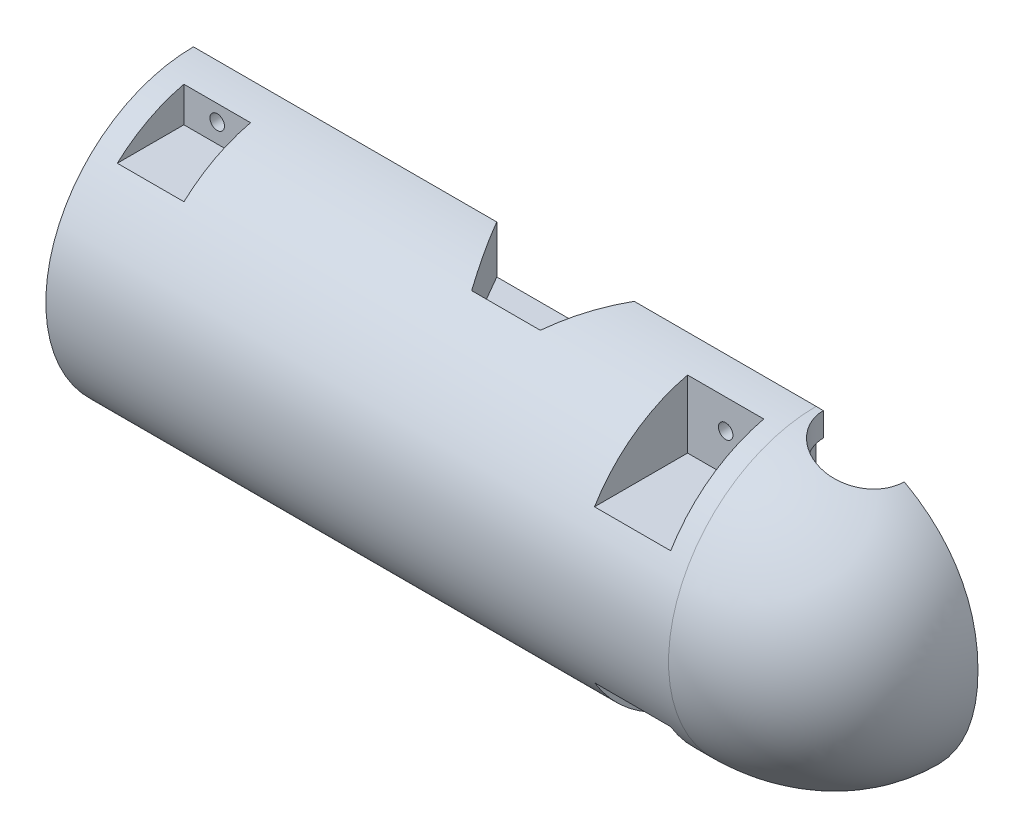
from build123d import *

# Parameters (mm, degrees)
REVOLVE1_ANGLE          = 180
CUT_EXTRUDE1_REACH      = 114.566
CUT_EXTRUDE1_END_RADIUS = 31
SKETCH2_W               = 14
SKETCH2_H               = 8.185848791
SKETCH2_W_2             = 16
SKETCH2_H_2             = 15
CUT_EXTRUDE2_REACH      = 114.566
SKETCH3_R               = 1.525
CUT_EXTRUDE3_DEPTH      = 10
CUT_EXTRUDE4_REACH      = 128.25
SKETCH6_R               = 8.5


with BuildPart() as part:
    # Sketch1 → Revolve1 (revolve)
    with BuildSketch(Plane.XY):
        with BuildLine():
            Line((6.218316837, 14), (6.218316837, 6))
            Line((6.218316837, 6), (3.718316837, 6))
            Line((3.718316837, 6), (3.718316837, 24.731367941))
            Line((3.718316837, 24.731367941), (-10.171408573, 24.731367941))
            Line((-10.171408573, 24.731367941), (-27.781683163, 24.731367941))
            Line((-27.781683163, 24.731367941), (-27.781683163, 26.554502519))
            Line((-27.781683163, 26.554502519), (-35.281683163, 26.554502519))
            Line((-35.281683163, 26.554502519), (-35.281683163, 24.731367941))
            Line((-35.281683163, 24.731367941), (-38.281683163, 24.731367941))
            Line((-38.281683163, 24.731367941), (-38.281683163, 21.534346957))
            Line((-38.281683163, 21.534346957), (-59.281683163, 20.416426404))
            Line((-59.281683163, 20.416426404), (-59.281683163, 24.731367941))
            Line((-59.281683163, 24.731367941), (-59.281683163, 31))
            Line((-59.281683163, 31), (-56.981683163, 31))
            Line((-56.981683163, 31), (71.518316837, 31))
            add(Edge.make_bspline(
                [(71.518316837, 31), (87.336893309, 31), (105.518316837, 21.771712161), (105.518316837, 0)],
                knots=[0, 0, 0, 0, 1, 1, 1, 1], degree=3))
            Line((105.518316837, 0), (100.518316813, 0))
            add(Edge.make_bspline(
                [(71.518316837, 26), (84.501211561, 26), (100.518316813, 18.460024777), (100.518316813, 0)],
                knots=[0, 0, 0, 0, 1, 1, 1, 1], degree=3))
            Line((71.518316837, 26), (71.518316837, 14))
            Line((71.518316837, 14), (6.218316837, 14))
        make_face()
    revolve(axis=Axis((-52.937293729, 0, 0), (1, 0, 0)), revolution_arc=REVOLVE1_ANGLE)

    # Cut-Extrude1: up to this cylinder (the profile starts inside it)
    cut_extrude1_end = Plane(origin=(6.118317, 0, 0), z_dir=(-1, 0, 0)) * Cylinder(CUT_EXTRUDE1_END_RADIUS, 398.932, mode=Mode.PRIVATE)
    # Sketch2 → Cut-Extrude1 (cut, up to the surface)
    with BuildSketch(Plane(origin=(0, 0, 7), x_dir=(-1, 0, 0), z_dir=(0, 0, -1)), mode=Mode.PRIVATE) as cut_extrude1_sk1:
        with Locations((47.281683163, 26.907075605)):
            Rectangle(SKETCH2_W, SKETCH2_H)
    cut_extrude1_tool1 = extrude(cut_extrude1_sk1.sketch, amount=-CUT_EXTRUDE1_REACH, mode=Mode.PRIVATE) & cut_extrude1_end
    add(cut_extrude1_tool1.solids().sort_by_distance((-47.281683, 26.907076, 7))[0], mode=Mode.SUBTRACT)
    # Sketch2 → Cut-Extrude1 (cut, up to the surface)
    with BuildSketch(Plane(origin=(0, 0, 7), x_dir=(-1, 0, 0), z_dir=(0, 0, -1)), mode=Mode.PRIVATE) as cut_extrude1_sk2:
        with Locations((-59.518316837, -23.5)):
            Rectangle(SKETCH2_W_2, SKETCH2_H_2)
    cut_extrude1_tool2 = extrude(cut_extrude1_sk2.sketch, amount=-CUT_EXTRUDE1_REACH, mode=Mode.PRIVATE) & cut_extrude1_end
    add(cut_extrude1_tool2.solids().sort_by_distance((59.518317, -23.5, 7))[0], mode=Mode.SUBTRACT)
    # Sketch2 → Cut-Extrude1 (cut, up to the surface)
    with BuildSketch(Plane(origin=(0, 0, 7), x_dir=(-1, 0, 0), z_dir=(0, 0, -1)), mode=Mode.PRIVATE) as cut_extrude1_sk3:
        with Locations((-59.518316837, 23.5)):
            Rectangle(SKETCH2_W_2, SKETCH2_H_2)
    cut_extrude1_tool3 = extrude(cut_extrude1_sk3.sketch, amount=-CUT_EXTRUDE1_REACH, mode=Mode.PRIVATE) & cut_extrude1_end
    add(cut_extrude1_tool3.solids().sort_by_distance((59.518317, 23.5, 7))[0], mode=Mode.SUBTRACT)
    # Sketch2 → Cut-Extrude1 (cut, up to the surface)
    with BuildSketch(Plane(origin=(0, 0, 7), x_dir=(-1, 0, 0), z_dir=(0, 0, -1)), mode=Mode.PRIVATE) as cut_extrude1_sk4:
        with Locations((47.281683163, -26.907075605)):
            Rectangle(SKETCH2_W, SKETCH2_H)
    cut_extrude1_tool4 = extrude(cut_extrude1_sk4.sketch, amount=-CUT_EXTRUDE1_REACH, mode=Mode.PRIVATE) & cut_extrude1_end
    add(cut_extrude1_tool4.solids().sort_by_distance((-47.281683, -26.907076, 7))[0], mode=Mode.SUBTRACT)

    # Sketch3 → Cut-Extrude2 (cut, up to next)
    with BuildSketch(Plane.XY.offset(7), mode=Mode.PRIVATE) as cut_extrude2_sk1:
        with Locations((-47.281683163, 26.814151209)):
            Circle(SKETCH3_R)
    cut_extrude2_tool1 = extrude(cut_extrude2_sk1.sketch, amount=-CUT_EXTRUDE2_REACH, mode=Mode.PRIVATE) & part.part
    # Sketch3 → Cut-Extrude2 (cut, up to next)
    with BuildSketch(Plane.XY.offset(7), mode=Mode.PRIVATE) as cut_extrude2_sk2:
        with Locations(Location((-47.281683163, -26.814151209, 0), (0, 0, 90))):
            Circle(SKETCH3_R)
    cut_extrude2_tool2 = extrude(cut_extrude2_sk2.sketch, amount=-CUT_EXTRUDE2_REACH, mode=Mode.PRIVATE) & part.part
    # Sketch3 → Cut-Extrude2 (cut, up to next)
    with BuildSketch(Plane.XY.offset(7), mode=Mode.PRIVATE) as cut_extrude2_sk3:
        with Locations((59.518316837, 24)):
            Circle(SKETCH3_R)
    cut_extrude2_tool3 = extrude(cut_extrude2_sk3.sketch, amount=-CUT_EXTRUDE2_REACH, mode=Mode.PRIVATE) & part.part
    # Sketch3 → Cut-Extrude2 (cut, up to next)
    with BuildSketch(Plane.XY.offset(7), mode=Mode.PRIVATE) as cut_extrude2_sk4:
        with Locations((59.518316837, -24)):
            Circle(SKETCH3_R)
    cut_extrude2_tool4 = extrude(cut_extrude2_sk4.sketch, amount=-CUT_EXTRUDE2_REACH, mode=Mode.PRIVATE) & part.part
    add(cut_extrude2_tool1.solids().sort_by_distance((-47.281683, 26.814151, 7))[0], mode=Mode.SUBTRACT)
    add(cut_extrude2_tool2.solids().sort_by_distance((-47.281683, -26.814151, 7))[0], mode=Mode.SUBTRACT)
    add(cut_extrude2_tool3.solids().sort_by_distance((59.518317, 24, 7))[0], mode=Mode.SUBTRACT)
    add(cut_extrude2_tool4.solids().sort_by_distance((59.518317, -24, 7))[0], mode=Mode.SUBTRACT)

    # Sketch5 → Cut-Extrude3 (cut)
    with BuildSketch(Plane(origin=(0, 31, 0), x_dir=(1, 0, 0), z_dir=(0, 1, 0))):
        Polygon((4.441941487, 0), (11.658819852, -12.5), (26.092576582, -12.5), (33.309454947, 0), (26.092576582, 12.5), (11.658819852, 12.5), align=None)
    extrude(amount=-CUT_EXTRUDE3_DEPTH, mode=Mode.SUBTRACT)

    # Sketch6 → Cut-Extrude4 (cut, up to next)
    with BuildSketch(Plane(origin=(0, 31, 0), x_dir=(1, 0, 0), z_dir=(0, 1, 0)), mode=Mode.PRIVATE) as cut_extrude4_sk1:
        with Locations((81.518316837, 0)):
            Circle(SKETCH6_R)
    cut_extrude4_tool1 = extrude(cut_extrude4_sk1.sketch, amount=-CUT_EXTRUDE4_REACH, mode=Mode.PRIVATE) & part.part
    add(cut_extrude4_tool1.solids().sort_by_distance((81.518317, 31, 0))[0], mode=Mode.SUBTRACT)


solid = part.part
